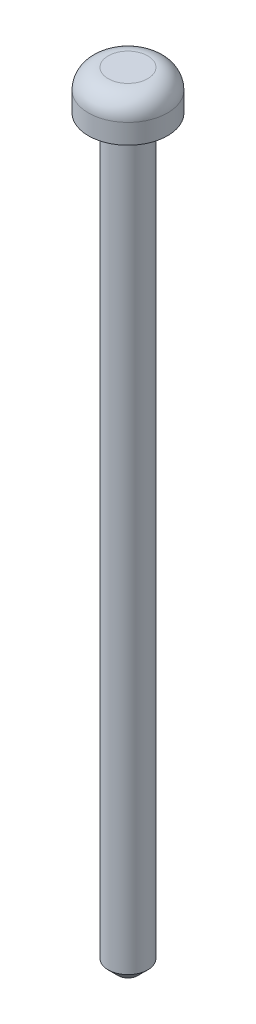
from build123d import *

# Parameters (mm, degrees)
SKETCH1_R           = 2.032
BOSS_EXTRUDE1_DEPTH = 76.2
SKETCH2_R           = 4.064
BOSS_EXTRUDE2_DEPTH = 4.064
FILLET1_R           = 2.032
CHAMFER1_SIZE       = 1.016


with BuildPart() as part:
    # Sketch1 → Boss-Extrude1 (new body)
    with BuildSketch(Plane(origin=(0, 0, 0), x_dir=(1, 0, 0), z_dir=(0, 1, 0))):
        with Locations(Location((0, 0, 0), (0, 0, 90))):
            Circle(SKETCH1_R)
    extrude(amount=BOSS_EXTRUDE1_DEPTH)

    # Sketch2 → Boss-Extrude2 (add)
    with BuildSketch(Plane(origin=(0, 76.2, 0), x_dir=(1, 0, 0), z_dir=(0, 1, 0))):
        with Locations(Location((0, 0, 0), (0, 0, 270))):
            Circle(SKETCH2_R)
    extrude(amount=BOSS_EXTRUDE2_DEPTH)

    # Fillet1
    fillet1_edges = [part.edges().sort_by_distance(p)[0] for p in [
        (0, 80.264, -4.064),
    ]]
    fillet(fillet1_edges, radius=FILLET1_R)

    # Chamfer1
    chamfer1_edges = [part.edges().sort_by_distance(p)[0] for p in [
        (0, 0, 2.032),
    ]]
    chamfer(chamfer1_edges, length=CHAMFER1_SIZE)


solid = part.part
